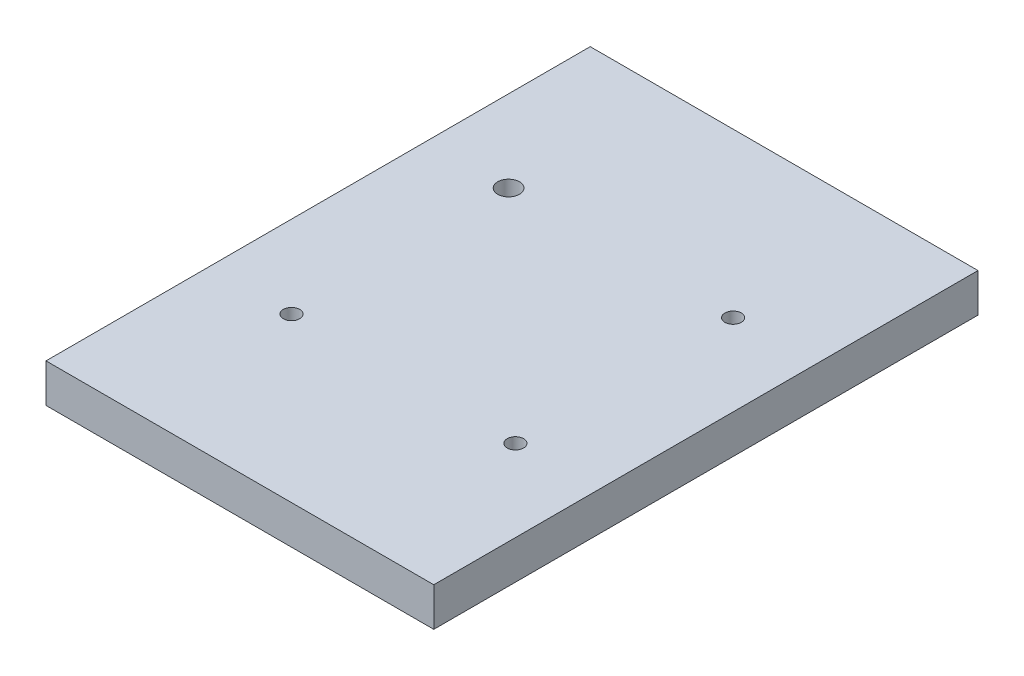
from build123d import *

# Parameters (mm, degrees)
SKETCH1_W           = 71.252977654
SKETCH1_H           = 100
BOSS_EXTRUDE1_DEPTH = 3.55
SKETCH6_R           = 1.5
SKETCH6_R_2         = 2
CUT_EXTRUDE11_DEPTH = 146.045946322


with BuildPart() as part:
    # Sketch1 → Boss-Extrude1 (new, symmetric)
    with BuildSketch(Plane(origin=(0, 0, 0.748863832), x_dir=(1, 0, 0), z_dir=(0, 1, 0))):
        with Locations((-9.840244689, -87.552508839)):
            Rectangle(SKETCH1_W, SKETCH1_H)
    extrude(amount=BOSS_EXTRUDE1_DEPTH, both=True)

    # Sketch6 → Cut-Extrude11 (cut, through all)
    with BuildSketch(Plane(origin=(0, 3.55, 0.748863832), x_dir=(1, 0, 0), z_dir=(0, 1, 0))):
        with Locations(Location((10.786244138, -67.552508839, 0), (0, 0, 270))):
            Circle(SKETCH6_R)
        with Locations(Location((-30.466733516, -67.552508839, 0), (0, 0, 270))):
            Circle(SKETCH6_R_2)
        with Locations(Location((10.786244138, -107.552508839, 0), (0, 0, 270))):
            Circle(SKETCH6_R)
        with Locations(Location((-30.35873493, -107.552508839, 0), (0, 0, 90))):
            Circle(SKETCH6_R)
    extrude(amount=-CUT_EXTRUDE11_DEPTH, mode=Mode.SUBTRACT)


solid = part.part
